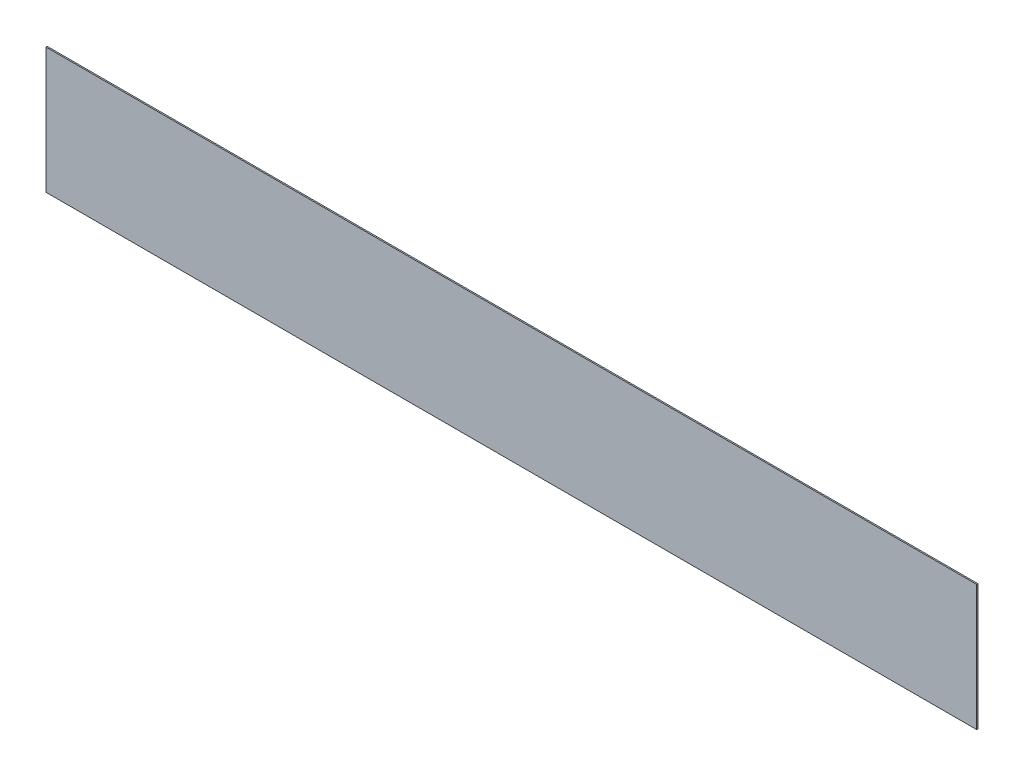
from build123d import *

# Parameters (mm, degrees)
SKETCH1_W           = 74
SKETCH1_H           = 10
BOSS_EXTRUDE1_DEPTH = 0.1


with BuildPart() as part:
    # Sketch1 → Boss-Extrude1 (new body)
    with BuildSketch(Plane.XY):
        Rectangle(SKETCH1_W, SKETCH1_H)
    extrude(amount=BOSS_EXTRUDE1_DEPTH)


solid = part.part
